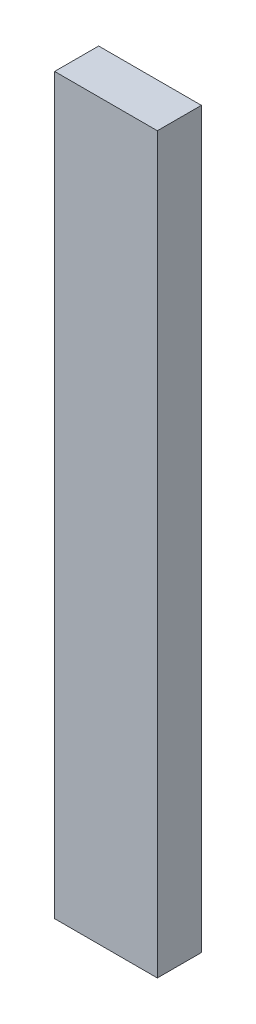
from build123d import *

# Parameters (mm, degrees)
SKETCH1_W           = 88.9
SKETCH1_H           = 38.1
BOSS_EXTRUDE1_DEPTH = 635


with BuildPart() as part:
    # Sketch1 → Boss-Extrude1 (new body)
    with BuildSketch(Plane(origin=(0, 0, 0), x_dir=(1, 0, 0), z_dir=(0, 1, 0))):
        with Locations((44.45, 19.05)):
            Rectangle(SKETCH1_W, SKETCH1_H)
    extrude(amount=BOSS_EXTRUDE1_DEPTH)


solid = part.part
